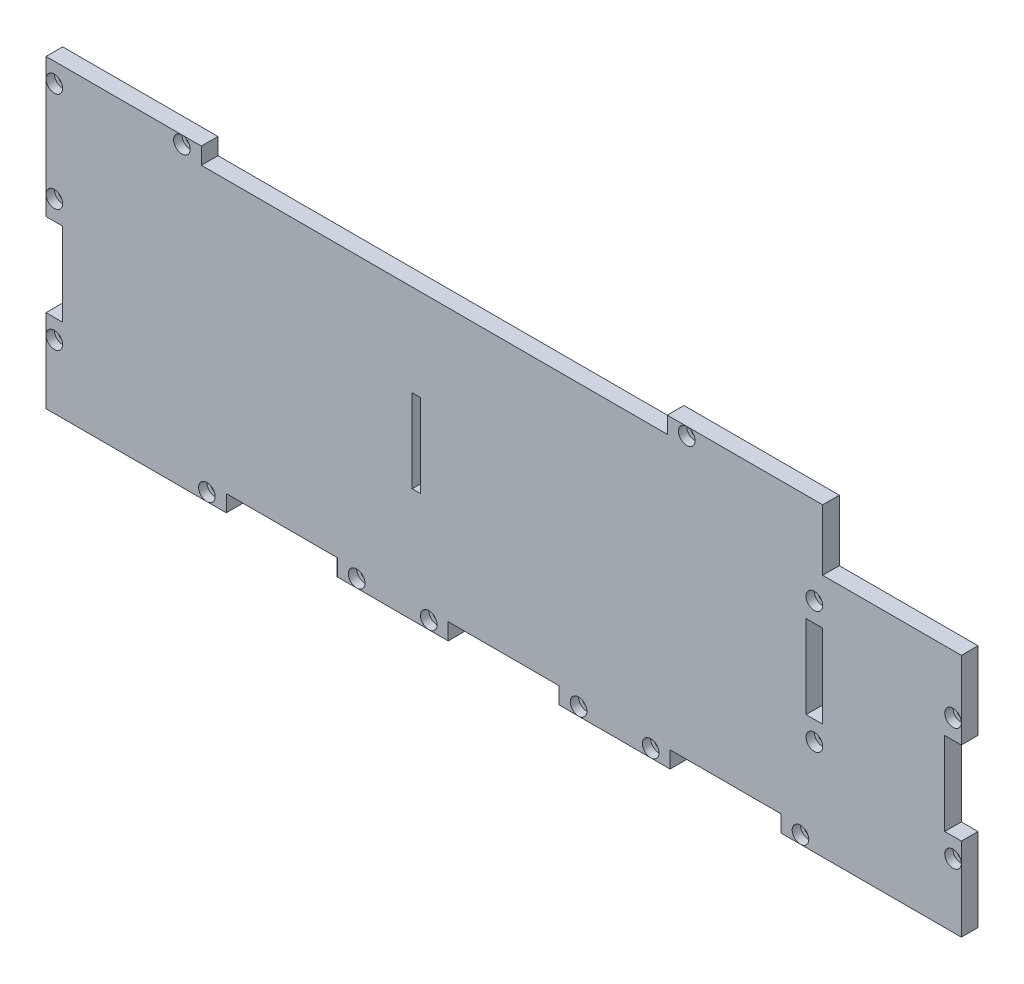
from build123d import *

# Parameters (mm, degrees)
ESQUISSE2_W             = 330
ESQUISSE2_H             = 110
BOSS_EXTRU_1_DEPTH      = 6
ESQUISSE4_W             = 168
ESQUISSE4_H             = 6
ESQUISSE4_W_2           = 6
ESQUISSE4_H_2           = 30
ESQUISSE4_W_3           = 50
ESQUISSE4_H_3           = 22
ESQUISSE4_W_4           = 40
ESQUISSE4_W_5           = 3
ENL_V_MAT_EXTRU_1_DEPTH = 348.902285132
ESQUISSE5_R             = 1.5
ENL_V_MAT_EXTRU_2_DEPTH = 6
ESQUISSE6_R             = 2.995
ESQUISSE6_R_2           = 3
ENL_V_MAT_EXTRU_3_DEPTH = 3


with BuildPart() as part:
    # Esquisse2 → Boss.-Extru.1 (new body)
    with BuildSketch(Plane.XY):
        with Locations((165, 55)):
            Rectangle(ESQUISSE2_W, ESQUISSE2_H)
    extrude(amount=BOSS_EXTRU_1_DEPTH)

    # Esquisse4 → Enlèv. mat.-Extru.1 (cut, through all)
    with BuildSketch(Plane.XY.offset(6)):
        with Locations((140, 107)):
            Rectangle(ESQUISSE4_W, ESQUISSE4_H)
        with Locations((3, 45)):
            Rectangle(ESQUISSE4_W_2, ESQUISSE4_H_2)
        with Locations((305, 99)):
            Rectangle(ESQUISSE4_W_3, ESQUISSE4_H_3)
        with Locations((85, 3)):
            Rectangle(ESQUISSE4_W_4, ESQUISSE4_H)
        with Locations((165, 3)):
            Rectangle(ESQUISSE4_W_4, ESQUISSE4_H)
        with Locations((245, 3)):
            Rectangle(ESQUISSE4_W_4, ESQUISSE4_H)
        with Locations((327, 45)):
            Rectangle(ESQUISSE4_W_2, ESQUISSE4_H_2)
        with Locations((133.5, 56)):
            Rectangle(ESQUISSE4_W_5, ESQUISSE4_H_2)
        with Locations((277, 56.5)):
            Rectangle(ESQUISSE4_W_2, ESQUISSE4_H_2)
    extrude(amount=-ENL_V_MAT_EXTRU_1_DEPTH, mode=Mode.SUBTRACT)

    # Esquisse5 → Enlèv. mat.-Extru.2 (cut)
    with BuildSketch(Plane.XY.offset(6)):
        with Locations((3, 23)):
            Circle(ESQUISSE5_R)
        with Locations((58, 3)):
            Circle(ESQUISSE5_R)
        with Locations((112, 3)):
            Circle(ESQUISSE5_R)
        with Locations((138, 3)):
            Circle(ESQUISSE5_R)
        with Locations((192, 3)):
            Circle(ESQUISSE5_R)
        with Locations((218, 3)):
            Circle(ESQUISSE5_R)
        with Locations((272, 3)):
            Circle(ESQUISSE5_R)
        with Locations((277, 34.5)):
            Circle(ESQUISSE5_R)
        with Locations((277, 78.5)):
            Circle(ESQUISSE5_R)
        with Locations((327, 67)):
            Circle(ESQUISSE5_R)
        with Locations((327, 23)):
            Circle(ESQUISSE5_R)
        with Locations((231, 107)):
            Circle(ESQUISSE5_R)
        with Locations((49, 107)):
            Circle(ESQUISSE5_R)
        with Locations((3, 103)):
            Circle(ESQUISSE5_R)
        with Locations((3, 67)):
            Circle(ESQUISSE5_R)
    extrude(amount=-ENL_V_MAT_EXTRU_2_DEPTH, mode=Mode.SUBTRACT)

    # Esquisse6 → Enlèv. mat.-Extru.3 (cut)
    with BuildSketch(Plane.XY.offset(6)):
        with Locations((3, 67)):
            Circle(ESQUISSE6_R)
        with Locations((3, 23)):
            Circle(ESQUISSE6_R)
        with Locations((3, 103)):
            Circle(ESQUISSE6_R)
        with Locations((49, 107)):
            Circle(ESQUISSE6_R)
        with Locations((231, 107)):
            Circle(ESQUISSE6_R)
        with Locations((277, 78.5)):
            Circle(ESQUISSE6_R_2)
        with Locations((327, 67)):
            Circle(ESQUISSE6_R)
        with Locations((277, 34.5)):
            Circle(ESQUISSE6_R)
        with Locations((327, 23)):
            Circle(ESQUISSE6_R)
        with Locations((272, 3)):
            Circle(ESQUISSE6_R)
        with Locations((218, 3)):
            Circle(ESQUISSE6_R)
        with Locations((192, 3)):
            Circle(ESQUISSE6_R)
        with Locations((138, 3)):
            Circle(ESQUISSE6_R)
        with Locations((112, 3)):
            Circle(ESQUISSE6_R)
        with Locations((58, 3)):
            Circle(ESQUISSE6_R)
    extrude(amount=-ENL_V_MAT_EXTRU_3_DEPTH, mode=Mode.SUBTRACT)


solid = part.part
